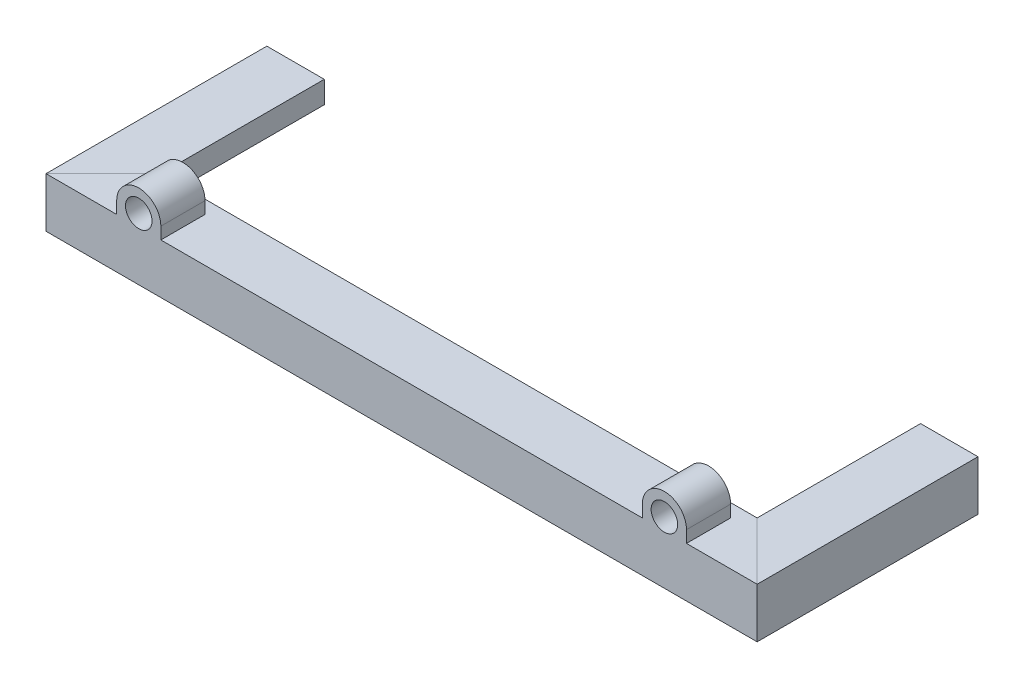
from build123d import *

# Parameters (mm, degrees)
SALIENTE_EXTRUIR1_DEPTH = 10
CROQUIS5_R              = 3
CORTAR_EXTRUIR1_DEPTH   = 170.652586187


with BuildPart() as part:
    # Barrer1: sweep along a path in Croquis3
    with BuildLine(Plane(origin=(0, 0, 0), x_dir=(1, 0, 0), z_dir=(0, 1, 0))) as barrer1_path:
        Line((0, 0), (0, -50))
        Line((0, -50), (161, -50))
        Line((161, -50), (161, 0))
    # Croquis1 → Barrer1 (sweep)
    with BuildSketch(Plane.XY):
        Polygon((0, 0), (0, 11.3), (13, 11.3), (13, 6.3), (5, 6.3), (5, 0), align=None)
    sweep(path=barrer1_path.line, transition=Transition.RIGHT)

    # Croquis4 → Saliente-Extruir1 (add)
    with BuildSketch(Plane.XY.offset(50)):
        with BuildLine():
            Line((16, 11.3), (26, 11.3))
            Line((26, 11.3), (26, 14))
            ThreePointArc((26, 14), (21, 19), (16, 14))
            Line((16, 14), (16, 11.3))
        make_face()
    saliente_extruir1 = extrude(amount=-SALIENTE_EXTRUIR1_DEPTH)

    # Croquis5 → Cortar-Extruir1 (cut, through all)
    with BuildSketch(Plane.XY.offset(50)):
        with Locations((21, 14)):
            Circle(CROQUIS5_R)
    cortar_extruir1 = extrude(amount=-CORTAR_EXTRUIR1_DEPTH, mode=Mode.SUBTRACT)

    # Simetría1: Saliente-Extruir1, Cortar-Extruir1 across plane
    add(saliente_extruir1.mirror(Plane(origin=(80.5, 0, 0), x_dir=(0, 0, 1), z_dir=(1, 0, 0))))
    add(cortar_extruir1.mirror(Plane(origin=(80.5, 0, 0), x_dir=(0, 0, 1), z_dir=(1, 0, 0))), mode=Mode.SUBTRACT)


solid = part.part
